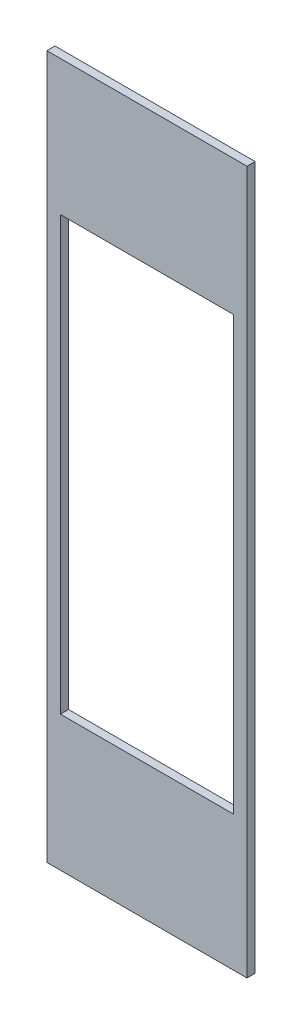
from build123d import *

# Parameters (mm, degrees)
ESBO_O1_W                = 370
ESBO_O1_H                = 1300
RESSALTO_EXTRUS_O1_DEPTH = 15
ESBO_O2_W                = 320
ESBO_O2_H                = 800
CORTE_EXTRUS_O1_DEPTH    = 15


with BuildPart() as part:
    # Esboço1 → Ressalto-extrusão1 (new body)
    with BuildSketch(Plane.XY):
        Rectangle(ESBO_O1_W, ESBO_O1_H)
    extrude(amount=RESSALTO_EXTRUS_O1_DEPTH)

    # Esboço2 → Corte-extrusão1 (cut)
    with BuildSketch(Plane.XY.offset(15)):
        Rectangle(ESBO_O2_W, ESBO_O2_H)
    extrude(amount=-CORTE_EXTRUS_O1_DEPTH, mode=Mode.SUBTRACT)


solid = part.part
